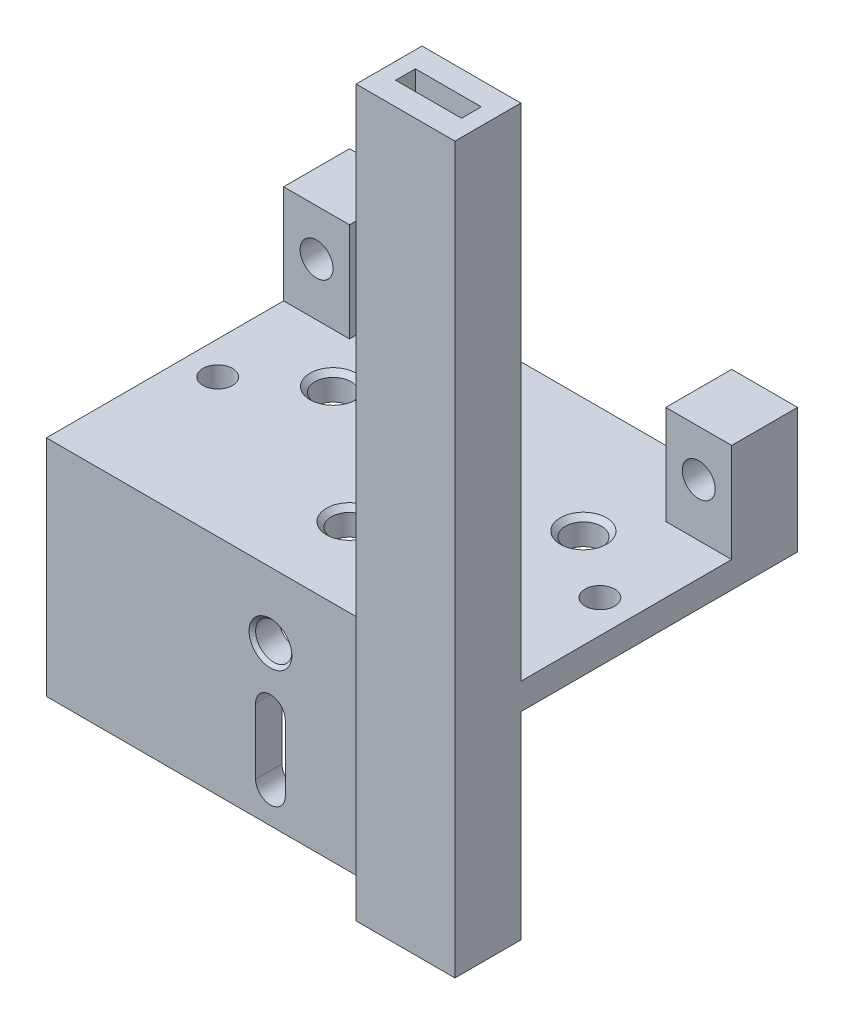
from build123d import *

# Parameters (mm, degrees)
SKETCH1_R           = 2.75
SKETCH1_R_2         = 2.25
BOSS_EXTRUDE1_DEPTH = 4
SKETCH3_W           = 10
SKETCH3_H           = 10
BOSS_EXTRUDE3_DEPTH = 15
SKETCH4_R           = 2.5
CUT_EXTRUDE1_DEPTH  = 58.280013966
CHAMFER1_SIZE       = 0.75
SKETCH5_W           = 4
SKETCH5_H           = 34
BOSS_EXTRUDE4_DEPTH = 68
SKETCH7_R           = 2.75
CUT_EXTRUDE2_DEPTH  = 62.806148561
CHAMFER2_SIZE       = 0.5
SKETCH8_W           = 15
SKETCH8_H           = 10
BOSS_EXTRUDE5_DEPTH = 110
CUT_EXTRUDE3_DEPTH  = 99.346326825
SKETCH10_W          = 10
SKETCH10_H          = 3
CUT_EXTRUDE4_DEPTH  = 122.885191882


with BuildPart() as part:
    # Sketch1 → Boss-Extrude1 (new body)
    with BuildSketch(Plane(origin=(0, 0, 0), x_dir=(1, 0, 0), z_dir=(0, 1, 0))):
        Polygon((-34, 0), (-34, 40), (34, 40), (34, 0), (34, -2), (-34, -2), align=None)
        with Locations(Location((-19, 22.5, 0), (0, 0, 270))):
            Circle(SKETCH1_R, mode=Mode.SUBTRACT)
        with Locations(Location((19, 22.5, 0), (0, 0, 270))):
            Circle(SKETCH1_R, mode=Mode.SUBTRACT)
        with Locations(Location((-29, 15, 0), (0, 0, 270))):
            Circle(SKETCH1_R_2, mode=Mode.SUBTRACT)
        with Locations(Location((29, 15, 0), (0, 0, 270))):
            Circle(SKETCH1_R_2, mode=Mode.SUBTRACT)
        with Locations(Location((0, 6, 0), (0, 0, 270))):
            Circle(SKETCH1_R, mode=Mode.SUBTRACT)
    extrude(amount=BOSS_EXTRUDE1_DEPTH)

    # Sketch3 → Boss-Extrude3 (add)
    with BuildSketch(Plane(origin=(0, 4, 0), x_dir=(1, 0, 0), z_dir=(0, 1, 0))):
        with Locations((-29, 35)):
            Rectangle(SKETCH3_W, SKETCH3_H)
        with Locations((29, 35)):
            Rectangle(SKETCH3_W, SKETCH3_H)
    extrude(amount=BOSS_EXTRUDE3_DEPTH)

    # Sketch4 → Cut-Extrude1 (cut, through all)
    with BuildSketch(Plane(origin=(0, 0, -40), x_dir=(-1, 0, 0), z_dir=(0, 0, -1))):
        with Locations((-29, 12)):
            Circle(SKETCH4_R)
        with Locations((29, 12)):
            Circle(SKETCH4_R)
    extrude(amount=-CUT_EXTRUDE1_DEPTH, mode=Mode.SUBTRACT)

    # Chamfer1
    chamfer1_edges = [part.edges().sort_by_distance(p)[0] for p in [
        (-19, 4, -25.25),
        (19, 4, -25.25),
        (0, 4, -8.75),
    ]]
    chamfer(chamfer1_edges, length=CHAMFER1_SIZE)

    # Sketch5 → Boss-Extrude4 (add)
    with BuildSketch(Plane.ZY.offset(34)):
        with Locations((4, -13)):
            Rectangle(SKETCH5_W, SKETCH5_H)
    extrude(amount=-BOSS_EXTRUDE4_DEPTH)

    # Sketch7 → Cut-Extrude2 (cut, through all)
    with BuildSketch(Plane(origin=(0, 0, 2), x_dir=(-1, 0, 0), z_dir=(0, 0, -1))):
        with Locations(Location((0, -6, 0), (0, 0, 90))):
            Circle(SKETCH7_R)
        with BuildLine():
            Line((2.25, -15), (2.25, -25))
            ThreePointArc((2.25, -25), (0, -27.25), (-2.25, -25))
            Line((-2.25, -25), (-2.25, -15))
            ThreePointArc((-2.25, -15), (0, -12.75), (2.25, -15))
        make_face()
    extrude(amount=-CUT_EXTRUDE2_DEPTH, mode=Mode.SUBTRACT)

    # Chamfer2
    chamfer2_edges = [part.edges().sort_by_distance(p)[0] for p in [
        (0, -8.75, 6),
    ]]
    chamfer(chamfer2_edges, length=CHAMFER2_SIZE)

    # Sketch8 → Boss-Extrude5 (add)
    with BuildSketch(Plane.XZ.offset(30)):
        with Locations((26.5, 7)):
            Rectangle(SKETCH8_W, SKETCH8_H)
    extrude(amount=-BOSS_EXTRUDE5_DEPTH)

    # Sketch9 → Cut-Extrude3 (cut, through all)
    with BuildSketch(Plane.XY.offset(6)):
        with BuildLine():
            Line((19, -3), (19, -24))
            ThreePointArc((19, -24), (17, -26), (15, -24))
            Line((15, -24), (15, -3))
            ThreePointArc((15, -3), (17, -1), (19, -3))
        make_face()
    extrude(amount=-CUT_EXTRUDE3_DEPTH, mode=Mode.SUBTRACT)

    # Sketch10 → Cut-Extrude4 (cut, through all)
    with BuildSketch(Plane(origin=(0, 80, 0), x_dir=(1, 0, 0), z_dir=(0, 1, 0))):
        with Locations((26.5, -7)):
            Rectangle(SKETCH10_W, SKETCH10_H)
    extrude(amount=-CUT_EXTRUDE4_DEPTH, mode=Mode.SUBTRACT)


solid = part.part
